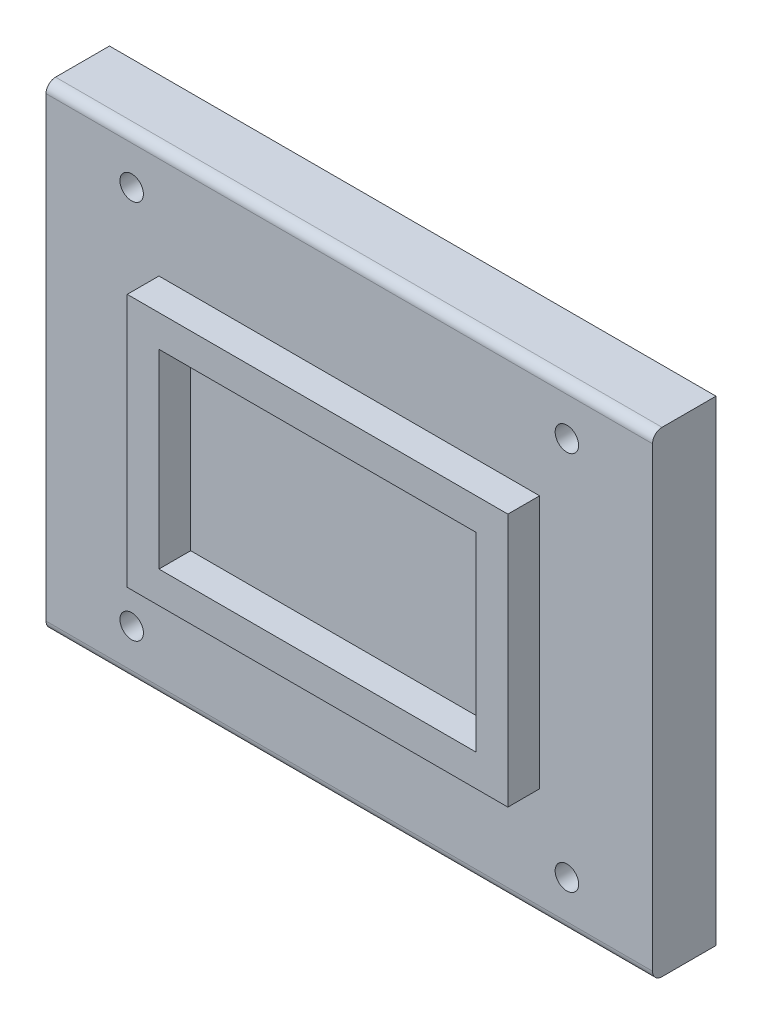
from build123d import *

# Parameters (mm, degrees)
SKETCH_1_W      = 95.6
SKETCH_1_H      = 75
SKETCH_1_R      = 1.85
EXTRUDE_1_DEPTH = 10
FILLET_1_R      = 1.5
SKETCH_2_W      = 60
SKETCH_2_H      = 40
SKETCH_2_W_2    = 50
SKETCH_2_H_2    = 30
EXTRUDE_2_DEPTH = 5


with BuildPart() as part:
    # 草圖1 → 填料-伸長1 (new body)
    with BuildSketch(Plane.XY):
        with Locations((8.347810078, -19.873101952)):
            Rectangle(SKETCH_1_W, SKETCH_1_H)
        with Locations((-25.952189922, 10.076898048)):
            Circle(SKETCH_1_R, mode=Mode.SUBTRACT)
        with Locations((42.647810078, 10.076898048)):
            Circle(SKETCH_1_R, mode=Mode.SUBTRACT)
        with Locations((-25.952189922, -49.823101952)):
            Circle(SKETCH_1_R, mode=Mode.SUBTRACT)
        with Locations((42.647810078, -49.823101952)):
            Circle(SKETCH_1_R, mode=Mode.SUBTRACT)
    extrude(amount=EXTRUDE_1_DEPTH)

    # 圓角1
    fillet_1_edges = [part.edges().sort_by_distance(p)[0] for p in [
        (8.347810078, 17.626898048, 10),
        (8.347810078, -57.373101952, 10),
    ]]
    fillet(fillet_1_edges, radius=FILLET_1_R)

    # 草圖2 → 填料-伸長2 (add)
    with BuildSketch(Plane.XY.offset(10)):
        with Locations((8.347810078, -19.873101952)):
            Rectangle(SKETCH_2_W, SKETCH_2_H)
        with Locations((8.347810078, -19.873101952)):
            Rectangle(SKETCH_2_W_2, SKETCH_2_H_2, mode=Mode.SUBTRACT)
    extrude(amount=EXTRUDE_2_DEPTH)


solid = part.part
